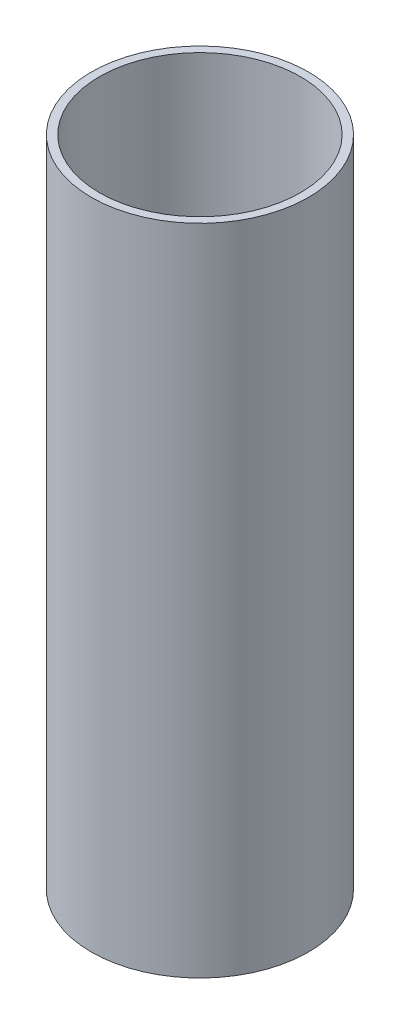
from build123d import *

# Parameters (mm, degrees)
SKETCH2_R           = 13.716
SKETCH2_R_2         = 12.7
BOSS_EXTRUDE1_DEPTH = 82.55


with BuildPart() as part:
    # Sketch2 → Boss-Extrude1 (new body)
    with BuildSketch(Plane(origin=(0, 0, 0), x_dir=(1, 0, 0), z_dir=(0, 1, 0))):
        with Locations(Location((0, 0, 0), (0, 0, 270))):
            Circle(SKETCH2_R)
        with Locations(Location((0, 0, 0), (0, 0, 270))):
            Circle(SKETCH2_R_2, mode=Mode.SUBTRACT)
    extrude(amount=BOSS_EXTRUDE1_DEPTH)


solid = part.part
